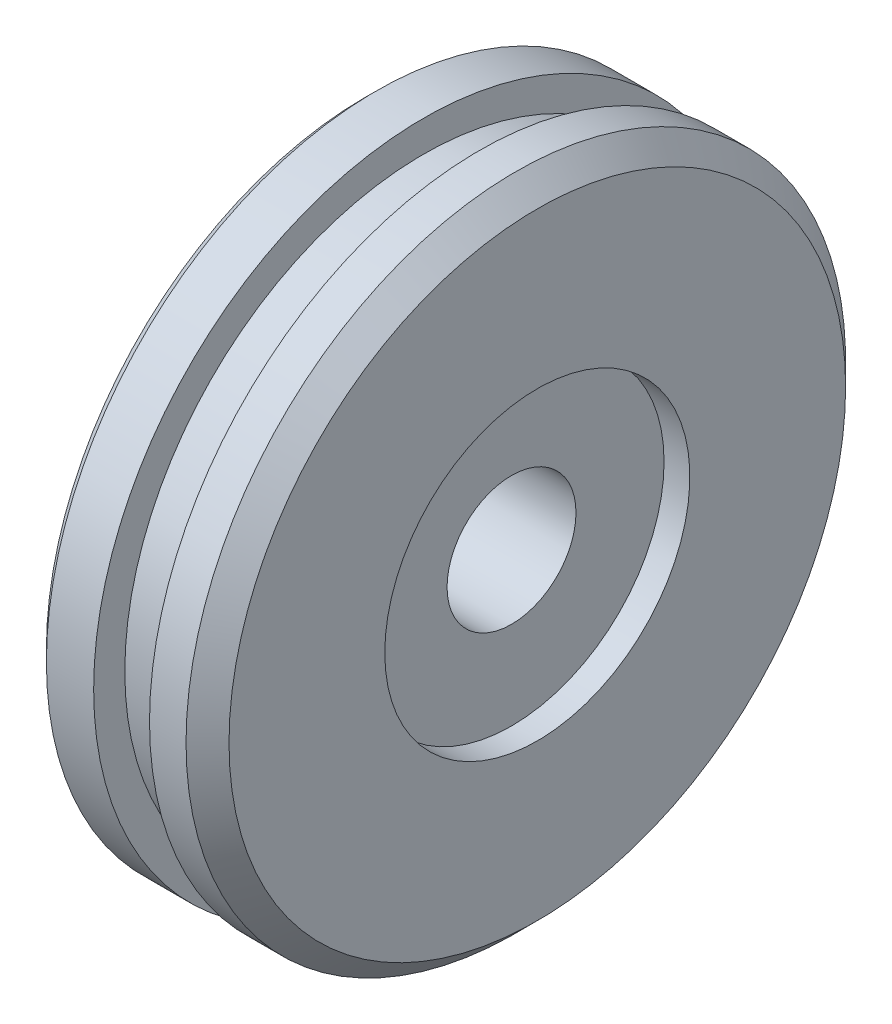
from build123d import *

# Parameters (mm, degrees)
SKETCH2_W            = 2.6
SKETCH2_H            = 2.45
BOSS_EXTRUDE1_START  = 62.7
SKETCH3_W            = 2.3
SKETCH3_H            = 23
BOSS_EXTRUDE1_DEPTH  = 6.6
BOSS_EXTRUDE2_START  = 54.5
SKETCH4_W            = 2.3
SKETCH4_H            = 6.6
BOSS_EXTRUDE2_DEPTH  = 23
BOSS_EXTRUDE3_START  = 76.7
SKETCH5_R            = 4.6
BOSS_EXTRUDE3_DEPTH  = 2.3
BOSS_EXTRUDE4_START  = 84
SKETCH6_R            = 7.1
BOSS_EXTRUDE4_DEPTH  = 1.7
BOSS_EXTRUDE5_START  = 78.9
SKETCH7_R            = 3
BOSS_EXTRUDE5_DEPTH  = 5.2
BOSS_EXTRUDE6_START  = 65.1
SKETCH8_W            = 4.1
SKETCH8_H            = 2.1
BOSS_EXTRUDE6_DEPTH  = 1.8
BOSS_EXTRUDE7_START  = 71.5
SKETCH9_W            = 4.1
SKETCH9_H            = 1.8
BOSS_EXTRUDE7_DEPTH  = 2.1
BOSS_EXTRUDE8_START  = 65.1
SKETCH10_W           = 4.1
SKETCH10_H           = 2.1
BOSS_EXTRUDE8_DEPTH  = 1.8
BOSS_EXTRUDE9_START  = 58.4
SKETCH11_W           = 4.1
SKETCH11_H           = 1.8
BOSS_EXTRUDE9_DEPTH  = 2.1
BOSS_EXTRUDE10_START = 65.1
SKETCH12_W           = 5.3
SKETCH12_H           = 2.4
BOSS_EXTRUDE10_DEPTH = 1.8
BOSS_EXTRUDE11_START = 73.6
SKETCH13_W           = 5.3
SKETCH13_H           = 1.8
BOSS_EXTRUDE11_DEPTH = 2.4
BOSS_EXTRUDE12_START = 65.1
SKETCH14_W           = 5.3
SKETCH14_H           = 2.4
BOSS_EXTRUDE12_DEPTH = 1.8
BOSS_EXTRUDE13_START = 56
SKETCH15_W           = 5.3
SKETCH15_H           = 1.8
BOSS_EXTRUDE13_DEPTH = 2.4


with BuildPart() as part:
    # Sketch1 → Revolve1 (revolve)
    with BuildSketch(Plane.XY.offset(66)):
        Polygon((77.2, -65), (85.2, -65), (85.2, -50.65), (84.2, -49.65), (77.7, -49.65), (77.2, -50.15), align=None)
    revolve(axis=Axis((72.2, -65, 66), (1, 0, 0)))


with BuildPart() as body_2:
    # Sketch2 → Revolve2 (revolve)
    with BuildSketch(Plane.XY.offset(66)):
        with Locations((81.2, -49.875)):
            Rectangle(SKETCH2_W, SKETCH2_H)
    revolve(axis=Axis((74.9, -65, 66), (1, 0, 0)))


with BuildPart() as part_1:
    add(part.part)

    # Combine1: cut body 2
    add(body_2.part, mode=Mode.SUBTRACT)


with BuildPart() as body_2_2:
    # Sketch3 → Boss-Extrude1 (new body)
    with BuildSketch(Plane.XY.offset(BOSS_EXTRUDE1_START)):
        with Locations((77.85, -65)):
            Rectangle(SKETCH3_W, SKETCH3_H)
    extrude(amount=BOSS_EXTRUDE1_DEPTH)


with BuildPart() as part_2:
    add(part_1.part)

    # Combine2: cut body 2 2
    add(body_2_2.part, mode=Mode.SUBTRACT)


with BuildPart() as body_2_3:
    # Sketch4 → Boss-Extrude2 (new body)
    with BuildSketch(Plane.XY.offset(BOSS_EXTRUDE2_START)):
        with Locations((77.85, -65)):
            Rectangle(SKETCH4_W, SKETCH4_H)
    extrude(amount=BOSS_EXTRUDE2_DEPTH)


with BuildPart() as part_3:
    add(part_2.part)

    # Combine3: cut body 2 3
    add(body_2_3.part, mode=Mode.SUBTRACT)


with BuildPart() as body_2_4:
    # Sketch5 → Boss-Extrude3 (new body)
    with BuildSketch(Plane(origin=(0, 0, 0), x_dir=(0, 0, -1), z_dir=(1, 0, 0)).offset(BOSS_EXTRUDE3_START)):
        with Locations((-66, -65)):
            Circle(SKETCH5_R)
    extrude(amount=BOSS_EXTRUDE3_DEPTH)


with BuildPart() as part_4:
    add(part_3.part)

    # Combine4: cut body 2 4
    add(body_2_4.part, mode=Mode.SUBTRACT)


with BuildPart() as body_2_5:
    # Sketch6 → Boss-Extrude4 (new body)
    with BuildSketch(Plane(origin=(0, 0, 0), x_dir=(0, 0, -1), z_dir=(1, 0, 0)).offset(BOSS_EXTRUDE4_START)):
        with Locations((-66, -65)):
            Circle(SKETCH6_R)
    extrude(amount=BOSS_EXTRUDE4_DEPTH)


with BuildPart() as part_5:
    add(part_4.part)

    # Combine5: cut body 2 5
    add(body_2_5.part, mode=Mode.SUBTRACT)


with BuildPart() as body_2_6:
    # Sketch7 → Boss-Extrude5 (new body)
    with BuildSketch(Plane(origin=(0, 0, 0), x_dir=(0, 0, -1), z_dir=(1, 0, 0)).offset(BOSS_EXTRUDE5_START)):
        with Locations((-66, -65)):
            Circle(SKETCH7_R)
    extrude(amount=BOSS_EXTRUDE5_DEPTH)


with BuildPart() as part_6:
    add(part_5.part)

    # Combine6: cut body 2 6
    add(body_2_6.part, mode=Mode.SUBTRACT)


with BuildPart() as body_2_7:
    # Sketch8 → Boss-Extrude6 (new body)
    with BuildSketch(Plane.XY.offset(BOSS_EXTRUDE6_START)):
        with Locations((80.95, -58.45)):
            Rectangle(SKETCH8_W, SKETCH8_H)
    extrude(amount=BOSS_EXTRUDE6_DEPTH)


with BuildPart() as part_7:
    add(part_6.part)

    # Combine7: cut body 2 7
    add(body_2_7.part, mode=Mode.SUBTRACT)


with BuildPart() as body_2_8:
    # Sketch9 → Boss-Extrude7 (new body)
    with BuildSketch(Plane.XY.offset(BOSS_EXTRUDE7_START)):
        with Locations((80.95, -65)):
            Rectangle(SKETCH9_W, SKETCH9_H)
    extrude(amount=BOSS_EXTRUDE7_DEPTH)


with BuildPart() as part_8:
    add(part_7.part)

    # Combine8: cut body 2 8
    add(body_2_8.part, mode=Mode.SUBTRACT)


with BuildPart() as body_2_9:
    # Sketch10 → Boss-Extrude8 (new body)
    with BuildSketch(Plane.XY.offset(BOSS_EXTRUDE8_START)):
        with Locations((80.95, -71.55)):
            Rectangle(SKETCH10_W, SKETCH10_H)
    extrude(amount=BOSS_EXTRUDE8_DEPTH)


with BuildPart() as part_9:
    add(part_8.part)

    # Combine9: cut body 2 9
    add(body_2_9.part, mode=Mode.SUBTRACT)


with BuildPart() as body_2_10:
    # Sketch11 → Boss-Extrude9 (new body)
    with BuildSketch(Plane.XY.offset(BOSS_EXTRUDE9_START)):
        with Locations((80.95, -65)):
            Rectangle(SKETCH11_W, SKETCH11_H)
    extrude(amount=BOSS_EXTRUDE9_DEPTH)


with BuildPart() as part_10:
    add(part_9.part)

    # Combine10: cut body 2 10
    add(body_2_10.part, mode=Mode.SUBTRACT)


with BuildPart() as body_2_11:
    # Sketch12 → Boss-Extrude10 (new body)
    with BuildSketch(Plane.XY.offset(BOSS_EXTRUDE10_START)):
        with Locations((81.55, -56.2)):
            Rectangle(SKETCH12_W, SKETCH12_H)
    extrude(amount=BOSS_EXTRUDE10_DEPTH)


with BuildPart() as part_11:
    add(part_10.part)

    # Combine11: cut body 2 11
    add(body_2_11.part, mode=Mode.SUBTRACT)


with BuildPart() as body_2_12:
    # Sketch13 → Boss-Extrude11 (new body)
    with BuildSketch(Plane.XY.offset(BOSS_EXTRUDE11_START)):
        with Locations((81.55, -65)):
            Rectangle(SKETCH13_W, SKETCH13_H)
    extrude(amount=BOSS_EXTRUDE11_DEPTH)


with BuildPart() as part_12:
    add(part_11.part)

    # Combine12: cut body 2 12
    add(body_2_12.part, mode=Mode.SUBTRACT)


with BuildPart() as body_2_13:
    # Sketch14 → Boss-Extrude12 (new body)
    with BuildSketch(Plane.XY.offset(BOSS_EXTRUDE12_START)):
        with Locations((81.55, -73.8)):
            Rectangle(SKETCH14_W, SKETCH14_H)
    extrude(amount=BOSS_EXTRUDE12_DEPTH)


with BuildPart() as part_13:
    add(part_12.part)

    # Combine13: cut body 2 13
    add(body_2_13.part, mode=Mode.SUBTRACT)


with BuildPart() as body_2_14:
    # Sketch15 → Boss-Extrude13 (new body)
    with BuildSketch(Plane.XY.offset(BOSS_EXTRUDE13_START)):
        with Locations((81.55, -65)):
            Rectangle(SKETCH15_W, SKETCH15_H)
    extrude(amount=BOSS_EXTRUDE13_DEPTH)


with BuildPart() as part_14:
    add(part_13.part)

    # Combine14: cut body 2 14
    add(body_2_14.part, mode=Mode.SUBTRACT)


solid = part_14.part
